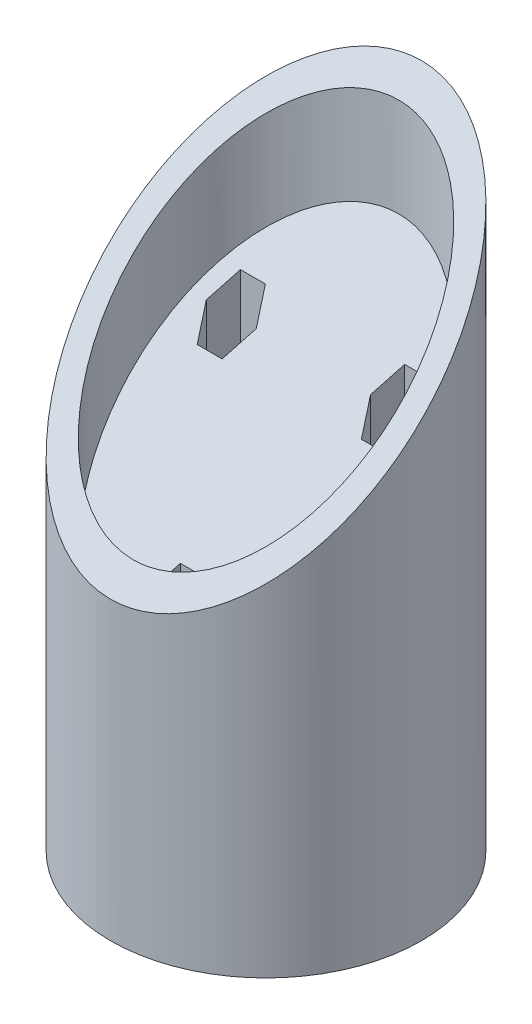
from build123d import *

# Parameters (mm, degrees)
SKETCH_1_R                  = 20.5
SKETCH_1_R_2                = 17.5
EXTRUDE_1_DEPTH             = 59
CUT_EXTRUDE_1_DEPTH         = 66.738116797
CUT_EXTRUDE_1_DEPTH_BACK    = 66.738116797
EXTRUDE_4_REACH             = 61.536
EXTRUDE_4_DIRECTION_2_REACH = 61.536
EXTRUDE_START               = 28
SKETCH_5_R                  = 20.5
EXTRUDE_5_DEPTH             = 28
CUT_EXTRUDE_6_DEPTH         = 84
SKETCH_15_R                 = 1.75
CUT_EXTRUDE_7_DEPTH         = 83.276971262


with BuildPart() as part:
    # Эскиз1 → Бобышка-Вытянуть1 (new body)
    with BuildSketch(Plane(origin=(0, 0, 0), x_dir=(1, 0, 0), z_dir=(0, 1, 0))):
        with Locations(Location((0, 0, 0), (0, 0, 270))):
            Circle(SKETCH_1_R)
        with Locations(Location((0, 0, 0), (0, 0, 270))):
            Circle(SKETCH_1_R_2, mode=Mode.SUBTRACT)
    extrude(amount=EXTRUDE_1_DEPTH)

    # Эскиз2 → Вырез-Вытянуть1 (cut, two sides: drawn at the far end of the back side and taken through both)
    with BuildSketch(Plane(origin=(0, 0, 0), x_dir=(0, 0, -1), z_dir=(1, 0, 0)).offset(-CUT_EXTRUDE_1_DEPTH_BACK)):
        Polygon((20.5, 59), (-20.5, 59), (-20.5, 11), (20.5, 52), align=None)
    extrude(amount=CUT_EXTRUDE_1_DEPTH + CUT_EXTRUDE_1_DEPTH_BACK, mode=Mode.SUBTRACT)

    # Эскиз3 → Бобышка-Вытянуть4 (add, up to next)
    with BuildSketch(Plane(origin=(0, 0, 0), x_dir=(0, 0, -1), z_dir=(1, 0, 0)), mode=Mode.PRIVATE) as extrude_4_sk1:
        Polygon((-17.5, 1), (17.5, 36), (17.5, 1), (17.5, 0), (-17.5, 0), align=None)
    extrude_4_tool1 = extrude(extrude_4_sk1.sketch, amount=EXTRUDE_4_REACH, mode=Mode.PRIVATE) - part.part
    add(extrude_4_tool1.solids().sort_by_distance((0, 12.009009, -5.518018))[0])

    # Эскиз3 → Бобышка-Вытянуть4 direction 2 (add, up to next)
    with BuildSketch(Plane(origin=(0, 0, 0), x_dir=(0, 0, -1), z_dir=(1, 0, 0)), mode=Mode.PRIVATE) as extrude_4_direction_2_sk1:
        Polygon((-17.5, 1), (17.5, 36), (17.5, 1), (17.5, 0), (-17.5, 0), align=None)
    extrude_4_direction_2_tool1 = extrude(extrude_4_direction_2_sk1.sketch, amount=-EXTRUDE_4_DIRECTION_2_REACH, mode=Mode.PRIVATE) - part.part
    add(extrude_4_direction_2_tool1.solids().sort_by_distance((0, 12.009009, -5.518018))[0])

    # Эскиз5 → Бобышка-Вытянуть5 (add)
    with BuildSketch(Plane.XZ.offset(EXTRUDE_START)):
        with Locations(Location((0, 0, 0), (0, 0, 270))):
            Circle(SKETCH_5_R)
    extrude(amount=-EXTRUDE_5_DEPTH)

    # Эскиз13 → Вырез-Вытянуть6 (cut)
    with BuildSketch(Plane(origin=(0, 59, 0), x_dir=(-1, 0, 0), z_dir=(0, -1, 0))):
        Polygon((7.534421013, 6.25), (9.17986928, 3.4), (12.470765814, 3.4), (14.116214082, 6.25), (12.470765814, 9.1), (9.17986928, 9.1), align=None)
        Polygon((-14.116214082, 6.25), (-12.470765814, 3.4), (-9.17986928, 3.4), (-7.534421013, 6.25), (-9.17986928, 9.1), (-12.470765814, 9.1), align=None)
        Polygon((-3.290896534, -12.5), (-1.645448267, -15.35), (1.645448267, -15.35), (3.290896534, -12.5), (1.645448267, -9.65), (-1.645448267, -9.65), align=None)
    extrude(amount=CUT_EXTRUDE_6_DEPTH, mode=Mode.SUBTRACT)

    # Эскиз15 → Вырез-Вытянуть7 (cut, through all)
    with BuildSketch(Plane(origin=(0, -25, 0), x_dir=(1, 0, 0), z_dir=(0, 1, 0))):
        with Locations(Location((10.825317547, 6.25, 0), (0, 0, 270))):
            Circle(SKETCH_15_R)
        with Locations(Location((-10.825317547, 6.25, 0), (0, 0, 270))):
            Circle(SKETCH_15_R)
        with Locations(Location((0, -12.5, 0), (0, 0, 270))):
            Circle(SKETCH_15_R)
    extrude(amount=-CUT_EXTRUDE_7_DEPTH, mode=Mode.SUBTRACT)


solid = part.part
